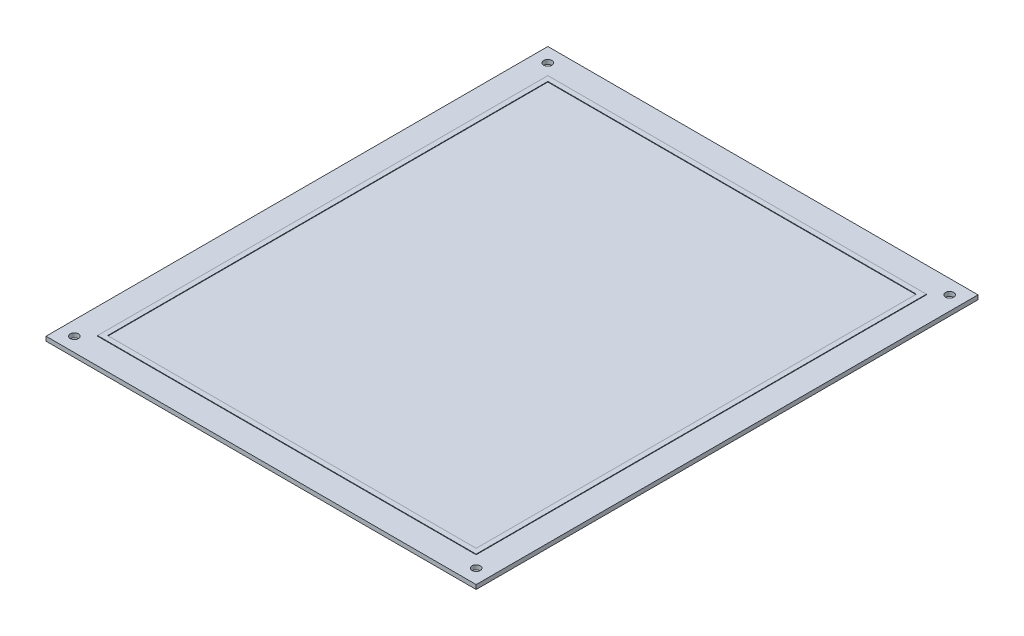
from build123d import *

# Parameters (mm, degrees)
SKETCH1_W                                     = 300
SKETCH1_H                                     = 350
SKETCH1_R                                     = 2.88
ELECTRONICS_TRAY_STRUCTURAL_PANEL_DEPTH       = 1.5
SKETCH2_W                                     = 264
SKETCH2_H                                     = 314
SKETCH2_W_2                                   = 257
SKETCH2_H_2                                   = 307
ELECTRONICS_TRAY_STRUCTURAL_PANEL_INSET_DEPTH = 1.9


with BuildPart() as part:
    # Sketch1 → Electronics tray structural panel (new, symmetric)
    with BuildSketch(Plane(origin=(0, 0, 0), x_dir=(1, 0, 0), z_dir=(0, 1, 0))):
        Rectangle(SKETCH1_W, SKETCH1_H)
        with Locations(Location((140.1, 165.1, 0), (0, 0, 270))):
            Circle(SKETCH1_R, mode=Mode.SUBTRACT)
        with Locations(Location((-140.1, 165.1, 0), (0, 0, 270))):
            Circle(SKETCH1_R, mode=Mode.SUBTRACT)
        with Locations(Location((140.1, -165.1, 0), (0, 0, 270))):
            Circle(SKETCH1_R, mode=Mode.SUBTRACT)
        with Locations(Location((-140.1, -165.1, 0), (0, 0, 270))):
            Circle(SKETCH1_R, mode=Mode.SUBTRACT)
    extrude(amount=ELECTRONICS_TRAY_STRUCTURAL_PANEL_DEPTH, both=True)

    # Sketch2 → Electronics tray structural panel inset stiffener (add, symmetric)
    with BuildSketch(Plane(origin=(0, 0, 0), x_dir=(1, 0, 0), z_dir=(0, 1, 0))):
        Rectangle(SKETCH2_W, SKETCH2_H)
        Rectangle(SKETCH2_W_2, SKETCH2_H_2, mode=Mode.SUBTRACT)
    extrude(amount=ELECTRONICS_TRAY_STRUCTURAL_PANEL_INSET_DEPTH, both=True)


solid = part.part
